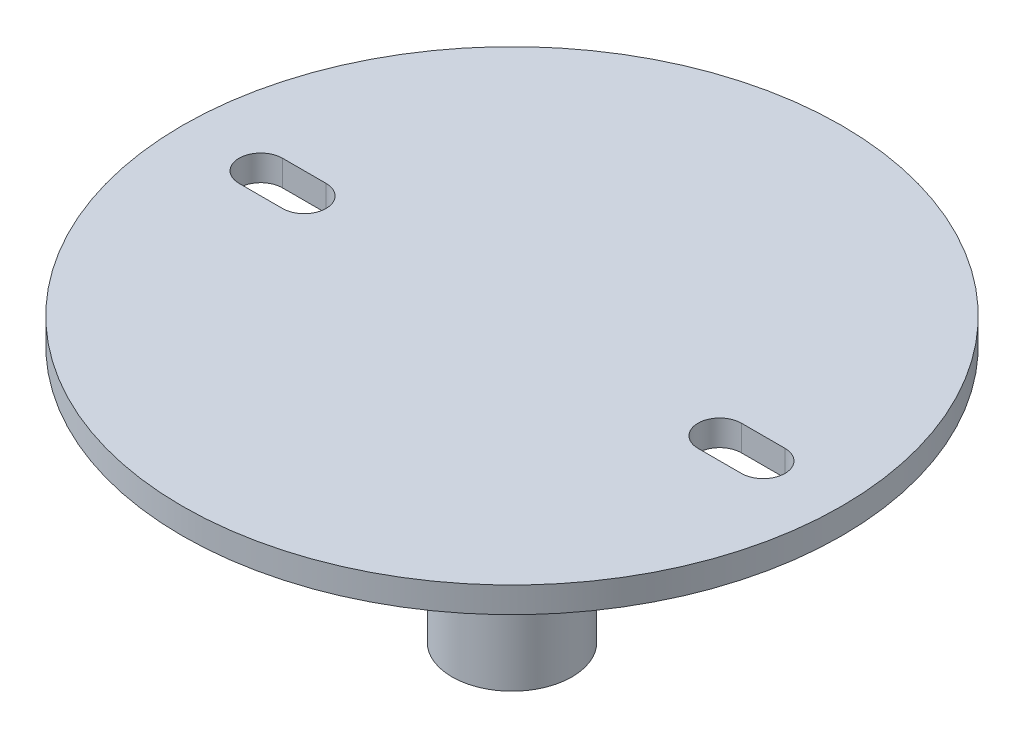
from build123d import *

# Parameters (mm, degrees)
SKETCH1_R           = 19.24
BOSS_EXTRUDE1_DEPTH = 1.5
SKETCH2_R           = 3.5
SKETCH2_R_2         = 2
BOSS_EXTRUDE2_DEPTH = 15
FILLET1_R           = 1


with BuildPart() as part:
    # Sketch1 → Boss-Extrude1 (new body)
    with BuildSketch(Plane(origin=(0, 0, 0), x_dir=(1, 0, 0), z_dir=(0, 1, 0))):
        with Locations(Location((0, 0, 0), (0, 0, 270))):
            Circle(SKETCH1_R)
        with BuildLine():
            Line((14.66, 1.27), (12.12, 1.27))
            ThreePointArc((12.12, 1.27), (10.85, 0), (12.12, -1.27))
            Line((12.12, -1.27), (14.66, -1.27))
            ThreePointArc((14.66, -1.27), (15.93, 0), (14.66, 1.27))
        make_face(mode=Mode.SUBTRACT)
        with BuildLine():
            Line((-14.66, -1.27), (-12.12, -1.27))
            ThreePointArc((-12.12, -1.27), (-10.85, 0), (-12.12, 1.27))
            Line((-12.12, 1.27), (-14.66, 1.27))
            ThreePointArc((-14.66, 1.27), (-15.93, 0), (-14.66, -1.27))
        make_face(mode=Mode.SUBTRACT)
    extrude(amount=BOSS_EXTRUDE1_DEPTH)

    # Sketch2 → Boss-Extrude2 (add)
    with BuildSketch(Plane(origin=(0, 0, 0), x_dir=(-1, 0, 0), z_dir=(0, -1, 0))):
        with Locations(Location((0, 0, 0), (0, 0, 270))):
            Circle(SKETCH2_R)
        with Locations(Location((0, 0, 0), (0, 0, 90))):
            Circle(SKETCH2_R_2, mode=Mode.SUBTRACT)
    extrude(amount=BOSS_EXTRUDE2_DEPTH)

    # Fillet1
    fillet1_edges = [part.edges().sort_by_distance(p)[0] for p in [
        (0, 0, -3.5),
    ]]
    fillet(fillet1_edges, radius=FILLET1_R)


solid = part.part
